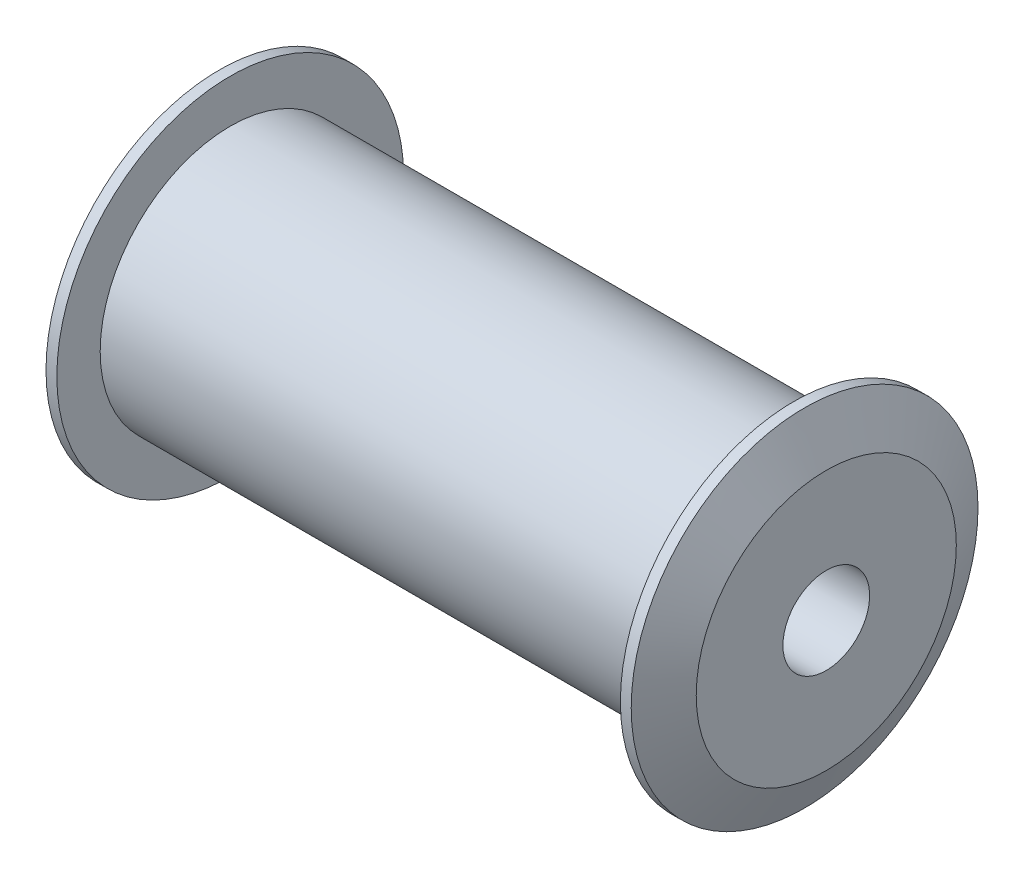
from build123d import *

# Parameters (mm, degrees)
CHAMFER_1_SIZE  = 1
CHAMFER_1_SIZE2 = 2
CHAMFER_2_SIZE  = 2
CHAMFER_2_SIZE2 = 1


with BuildPart() as part:
    # 草图2 → 旋转1 (revolve)
    with BuildSketch(Plane.XY, mode=Mode.PRIVATE) as revolve_1_sk:
        Polygon((-13, 53), (13, 53), (13, 55), (14.5, 55), (14.5, 49), (-14.5, 49), (-14.5, 55), (-13, 55), align=None)
    revolve(revolve_1_sk.sketch.rotate(Axis((-54.733238043, 47, 0), (1, 0, 0)), 90), axis=Axis((-54.733238043, 47, 0), (1, 0, 0)))

    # 倒角1
    chamfer_1_edges = [part.edges().sort_by_distance(p)[0] for p in [
        (-14.5, 47, -8),
    ]]
    chamfer_1_side = [part.faces().sort_by_distance(p)[0] for p in [
        (-13.75, 47, -8),
    ]]
    chamfer(chamfer_1_edges, length=CHAMFER_1_SIZE, length2=CHAMFER_1_SIZE2, reference=chamfer_1_side[0])

    # 倒角2
    chamfer_2_edges = [part.edges().sort_by_distance(p)[0] for p in [
        (14.5, 47, -8),
    ]]
    chamfer_2_side = [part.faces().sort_by_distance(p)[0] for p in [
        (14.5, 47, -7.77372583),
    ]]
    chamfer(chamfer_2_edges, length=CHAMFER_2_SIZE, length2=CHAMFER_2_SIZE2, reference=chamfer_2_side[0])


solid = part.part
